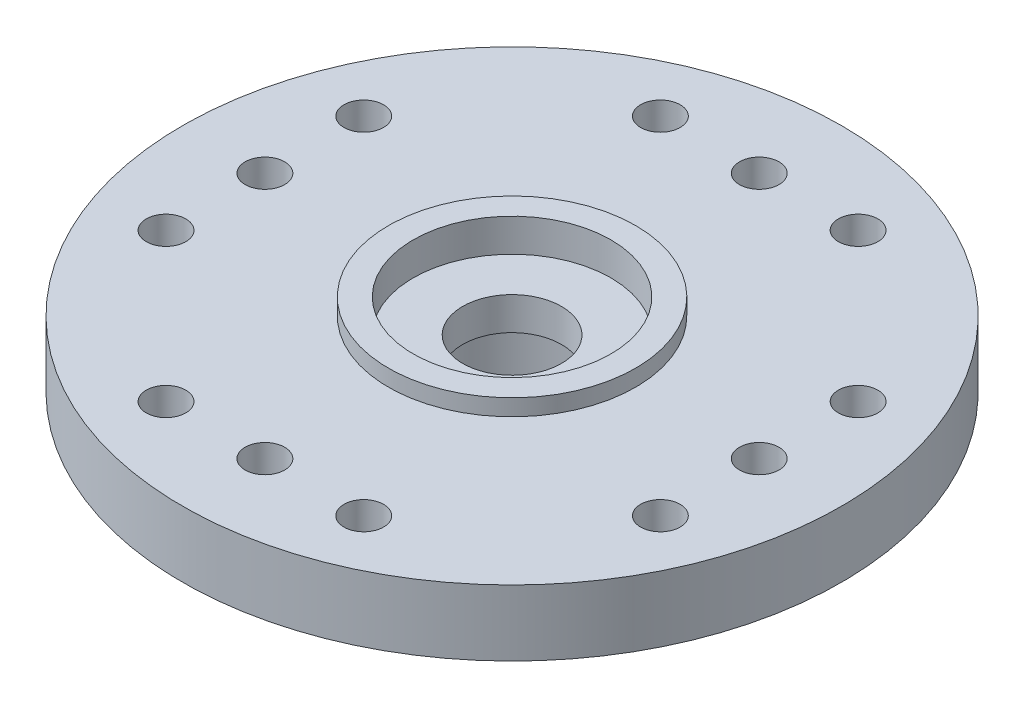
from build123d import *

# Parameters (mm, degrees)
SKETCH1_R          = 0.6
CUT_EXTRUDE1_DEPTH = 2
CIRPATTERN1_COUNT  = 4


with BuildPart() as part:
    # Esquisse1 → Révolution1 (revolve)
    with BuildSketch(Plane.XY, mode=Mode.PRIVATE) as r_volution1_sk:
        Polygon((2.75, 0), (2.75, 3), (1.5, 3), (1.5, 4), (3, 4), (3, 5), (3.75, 5), (3.75, 4.5), (10, 4.5), (10, 2.5), (4.5, 2.5), (4.5, 0), align=None)
    revolve(r_volution1_sk.sketch.rotate(Axis((0, 0, 0), (0, 1, 0)), 90), axis=Axis((0, 0, 0), (0, 1, 0)))

    # Sketch1 → Cut-Extrude1 (cut)
    with BuildSketch(Plane(origin=(0, 4.5, 0), x_dir=(1, 0, 0), z_dir=(0, 1, 0))):
        with Locations(Location((0, 7.5, 0), (0, 0, 270))):
            Circle(SKETCH1_R)
        with Locations(Location((3, 7.5, 0), (0, 0, 270))):
            Circle(SKETCH1_R)
        with Locations(Location((-3, 7.5, 0), (0, 0, 90))):
            Circle(SKETCH1_R)
    cut_extrude1 = extrude(amount=-CUT_EXTRUDE1_DEPTH, mode=Mode.SUBTRACT)

    # CirPattern1: Cut-Extrude1 ×4 about axis
    cirpattern1_axis = Axis((0, 0, 0), (0, 1, 0))
    for i in range(1, CIRPATTERN1_COUNT):
        add(cut_extrude1.rotate(cirpattern1_axis, i * 360 / CIRPATTERN1_COUNT), mode=Mode.SUBTRACT)


solid = part.part
